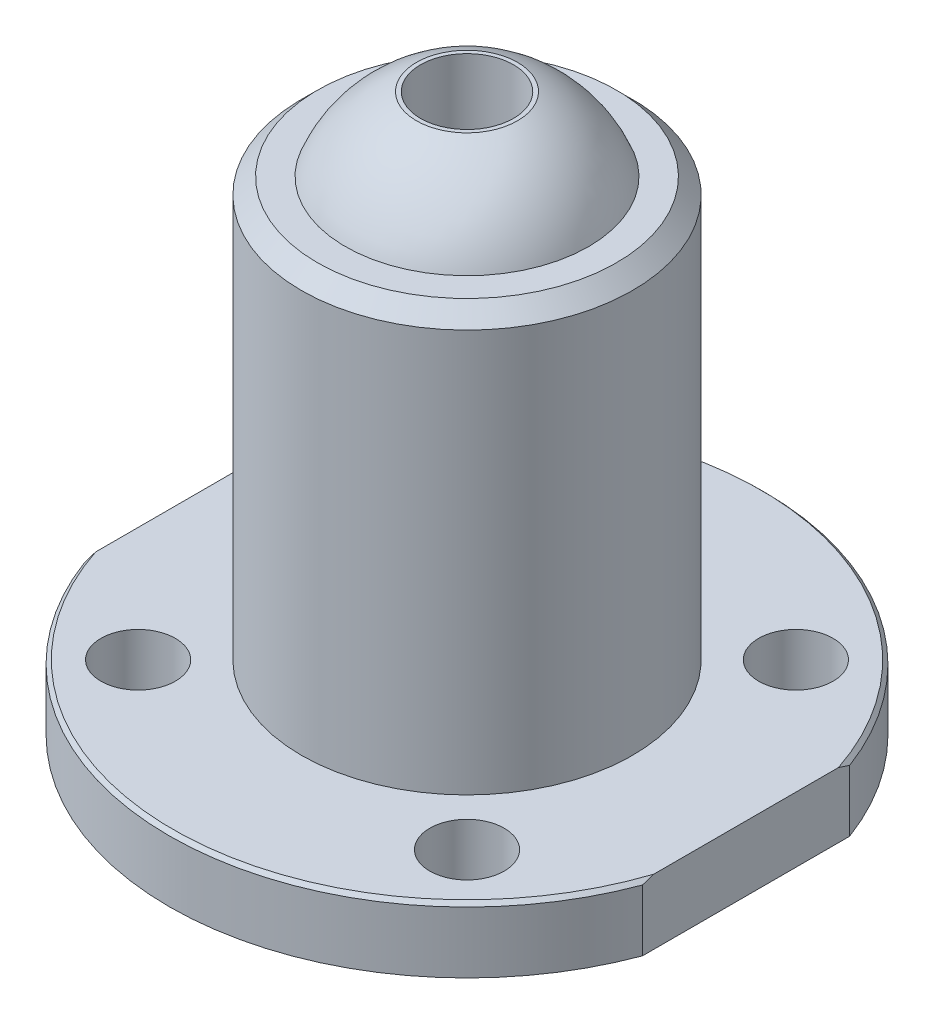
from build123d import *

# Parameters (mm, degrees)
SKETCH_2_R          = 2.5
CUT_EXTRUDE_1_DEPTH = 5
SKETCH_3_R          = 2
CUT_EXTRUDE_2_DEPTH = 5
CHAMFER_1_SIZE      = 0.2


with BuildPart() as part:
    # 草图1 → 旋转1 (revolve)
    with BuildSketch(Plane.XY, mode=Mode.PRIVATE) as revolve_1_sk:
        with BuildLine():
            Line((0, 0), (16, 0))
            Line((16, 0), (16, 3.5))
            Line((16, 3.5), (8.9, 3.5))
            Line((8.9, 3.5), (8.9, 25.138348415))
            Line((8.9, 25.138348415), (8.038348415, 26))
            Line((8.038348415, 26), (6.538348415, 26))
            ThreePointArc((6.538348415, 26), (5.032803689, 28.365273582), (2.719834554, 29.95))
            Line((2.719834554, 29.95), (0, 29.95))
            Line((0, 29.95), (0, 0))
        make_face()
    revolve(revolve_1_sk.sketch.rotate(Axis((0, 33.582842794, 0), (0, -1, 0)), 90), axis=Axis((0, 33.582842794, 0), (0, -1, 0)))

    # 草图2 → 切除-拉伸1 (cut)
    with BuildSketch(Plane(origin=(0, 29.95, 0), x_dir=(1, 0, 0), z_dir=(0, 1, 0))):
        with Locations(Location((0, 0, 0), (0, 0, 270))):
            Circle(SKETCH_2_R)
    extrude(amount=-CUT_EXTRUDE_1_DEPTH, mode=Mode.SUBTRACT)

    # 草图3 → 切除-拉伸2 (cut)
    with BuildSketch(Plane(origin=(0, 3.5, 0), x_dir=(1, 0, 0), z_dir=(0, 1, 0))):
        with Locations(Location((8.838834765, 8.838834765, 0), (0, 0, 270))):
            Circle(SKETCH_3_R)
        with Locations(Location((8.838834765, -8.838834765, 0), (0, 0, 270))):
            Circle(SKETCH_3_R)
        with Locations(Location((-8.838834765, -8.838834765, 0), (0, 0, 270))):
            Circle(SKETCH_3_R)
        with Locations(Location((-8.838834765, 8.838834765, 0), (0, 0, 270))):
            Circle(SKETCH_3_R)
        with BuildLine():
            Line((-15, 5.567764363), (-15, -5.567764363))
            ThreePointArc((-15, -5.567764363), (-16, 0), (-15, 5.567764363))
        make_face()
        with BuildLine():
            Line((15, 5.567764363), (15, -5.567764363))
            ThreePointArc((15, -5.567764363), (16, 0), (15, 5.567764363))
        make_face()
    extrude(amount=-CUT_EXTRUDE_2_DEPTH, mode=Mode.SUBTRACT)

    # 倒角1
    chamfer_1_edges = [part.edges().sort_by_distance(p)[0] for p in [
        (0, 3.5, -16),
        (0, 3.5, 16),
    ]]
    chamfer(chamfer_1_edges, length=CHAMFER_1_SIZE)


solid = part.part
